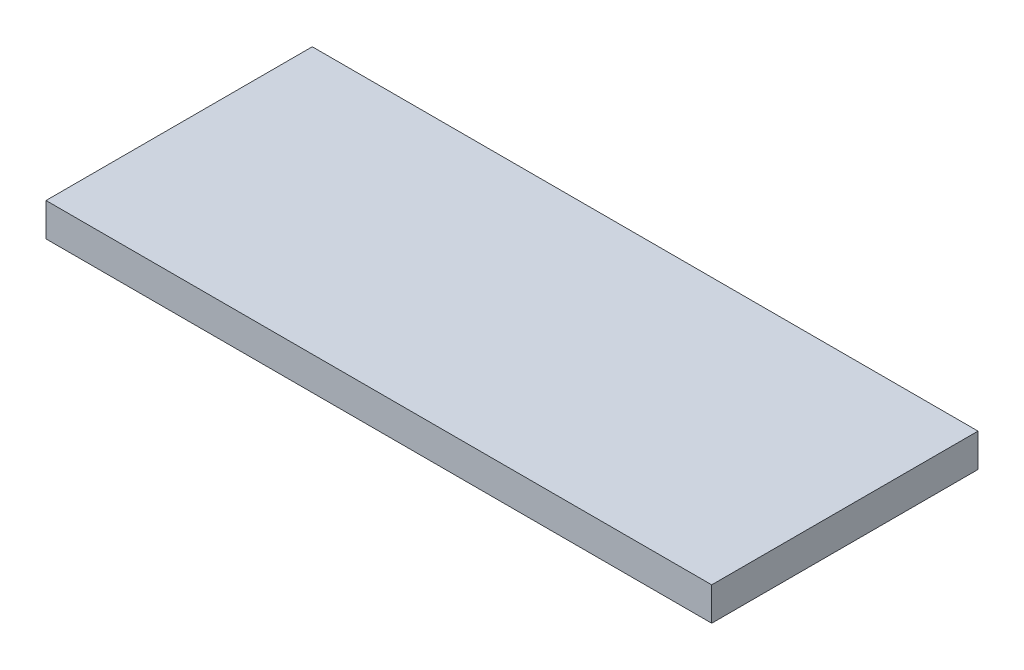
from build123d import *

# Parameters (mm, degrees)
SKETCH1_W           = 63.5
SKETCH1_H           = 25.4
BOSS_EXTRUDE1_DEPTH = 3.175


with BuildPart() as part:
    # Sketch1 → Boss-Extrude1 (new body)
    with BuildSketch(Plane(origin=(0, 0, 0), x_dir=(1, 0, 0), z_dir=(0, 1, 0))):
        with Locations((31.75, -12.7)):
            Rectangle(SKETCH1_W, SKETCH1_H)
    extrude(amount=BOSS_EXTRUDE1_DEPTH)


solid = part.part
